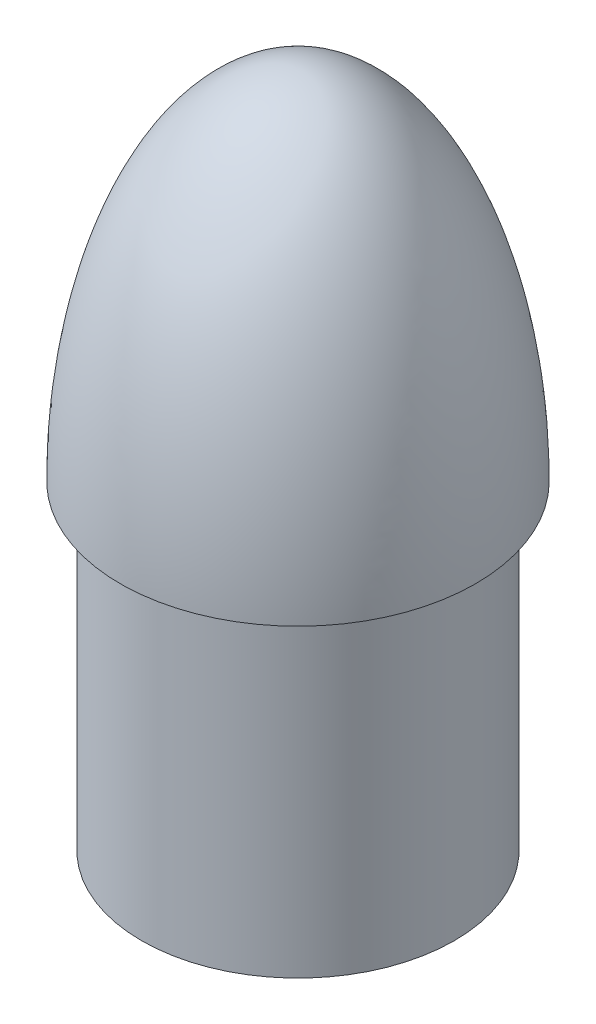
from build123d import *


with BuildPart() as part:
    # Sketch1 → Revolve1 (revolve)
    with BuildSketch(Plane.XY):
        with BuildLine():
            Line((25.000000002, 0), (22, 0))
            Line((22, 0), (22, -45))
            Line((22, -45), (0, -45))
            Line((0, -45), (0, 49.999999999))
            add(Edge.make_bspline(
                [(0, 49.999999999), (0.150346697, 49.999999999), (0.44990103, 49.994768682), (1.117978976, 49.963381232), (1.859247523, 49.872254656), (2.653413717, 49.730499012), (3.400203421, 49.540421444), (4.007632249, 49.360434184), (4.594769595, 49.153722302), (5.17906371, 48.921564539), (5.892616605, 48.601228934), (6.826878247, 48.121168992), (7.99168848, 47.412146065), (9.343995112, 46.418571746), (10.722864456, 45.20915945), (12.036476011, 43.863036719), (13.363996313, 42.303153189), (14.864026124, 40.279897763), (16.457688777, 37.750181335), (18.068578637, 34.688168195), (19.572333527, 31.24074209), (20.856534713, 27.706387698), (21.942968929, 24.106770342), (22.848406797, 20.457763058), (23.585695773, 16.771359999), (24.164587334, 13.057032093), (24.591990878, 9.325309515), (24.872671498, 5.592349999), (24.97696644, 2.790575574), (25.000000011, 0.926977799), (25.000000002, 0)],
                knots=[0.039903098, 0.039903098, 0.039903098, 0.039903098, 0.039903098, 0.049834709, 0.059766319, 0.079629492, 0.089561092, 0.099492693, 0.109424294, 0.119355895, 0.129287546, 0.139219196, 0.159082562, 0.185895679, 0.215690409, 0.245485318, 0.275280359, 0.305075209, 0.345512787, 0.4051024, 0.464692345, 0.524281796, 0.583871544, 0.643460648, 0.703050611, 0.762637698, 0.822223936, 0.881806617, 0.941209114, 1, 1, 1, 1, 1], degree=4))
        make_face()
    revolve(axis=Axis((0, -45, 0), (0, 1, 0)))


solid = part.part
